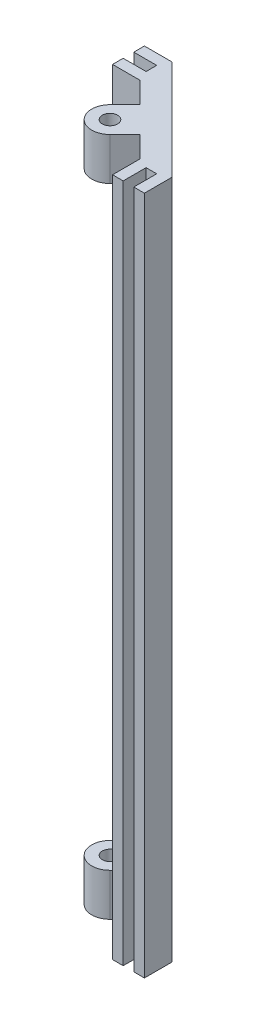
from build123d import *

# Parameters (mm, degrees)
SKETCH1_R           = 2.286
BOSS_EXTRUDE1_DEPTH = 203.2
SKETCH2_W           = 10.922
SKETCH2_H           = 177.8
CUT_EXTRUDE1_DEPTH  = 11.811
SKETCH3_W           = 6.35
SKETCH3_H           = 177.8
BOSS_EXTRUDE2_DEPTH = 1.27


with BuildPart() as part:
    # Sketch1 → Boss-Extrude1 (new body)
    with BuildSketch(Plane(origin=(0, 0, 0), x_dir=(1, 0, 0), z_dir=(0, 1, 0))):
        with BuildLine():
            Line((38.1, 0), (38.1, 8.209871939))
            Line((38.1, 8.209871939), (8.209871939, 38.1))
            Line((8.209871939, 38.1), (0, 38.1))
            Line((0, 38.1), (0, 34.925))
            Line((0, 34.925), (6.858, 34.925))
            Line((6.858, 34.925), (6.858, 31.75))
            Line((6.858, 31.75), (0, 31.75))
            Line((0, 31.75), (0, 28.575))
            Line((0, 28.575), (8.209871939, 28.575))
            Line((8.209871939, 28.575), (14.530925838, 22.253946102))
            Line((14.530925838, 22.253946102), (10.040797777, 17.763818041))
            ThreePointArc((10.040797777, 17.763818041), (10.040797777, 10.040797777), (17.763818041, 10.040797777))
            Line((17.763818041, 10.040797777), (22.253946102, 14.530925838))
            Line((22.253946102, 14.530925838), (28.575, 8.209871939))
            Line((28.575, 8.209871939), (28.575, 0))
            Line((28.575, 0), (31.75, 0))
            Line((31.75, 0), (31.75, 6.858))
            Line((31.75, 6.858), (34.925, 6.858))
            Line((34.925, 6.858), (34.925, 0))
            Line((34.925, 0), (38.1, 0))
        make_face()
        with Locations(Location((13.902307909, 13.902307909, 0), (0, 0, 270))):
            Circle(SKETCH1_R, mode=Mode.SUBTRACT)
    extrude(amount=BOSS_EXTRUDE1_DEPTH)

    # Sketch2 → Cut-Extrude1 (cut)
    with BuildSketch(Plane(origin=(18.39243597, 0, -18.39243597), x_dir=(0.7071067811865541, 0, 0.7071067811865409), z_dir=(-0.7071067811865409, 0, 0.7071067811865541))):
        with Locations((0, 101.6)):
            Rectangle(SKETCH2_W, SKETCH2_H)
    extrude(amount=CUT_EXTRUDE1_DEPTH, mode=Mode.SUBTRACT)

    # Sketch3 → Boss-Extrude2 (add)
    with BuildSketch(Plane(origin=(18.39243597, 0, -18.39243597), x_dir=(0.7071067811865479, 0, 0.7071067811865472), z_dir=(-0.7071067811865472, 0, 0.7071067811865479))):
        with Locations((0, 101.6)):
            Rectangle(SKETCH3_W, SKETCH3_H)
    extrude(amount=BOSS_EXTRUDE2_DEPTH)


solid = part.part
